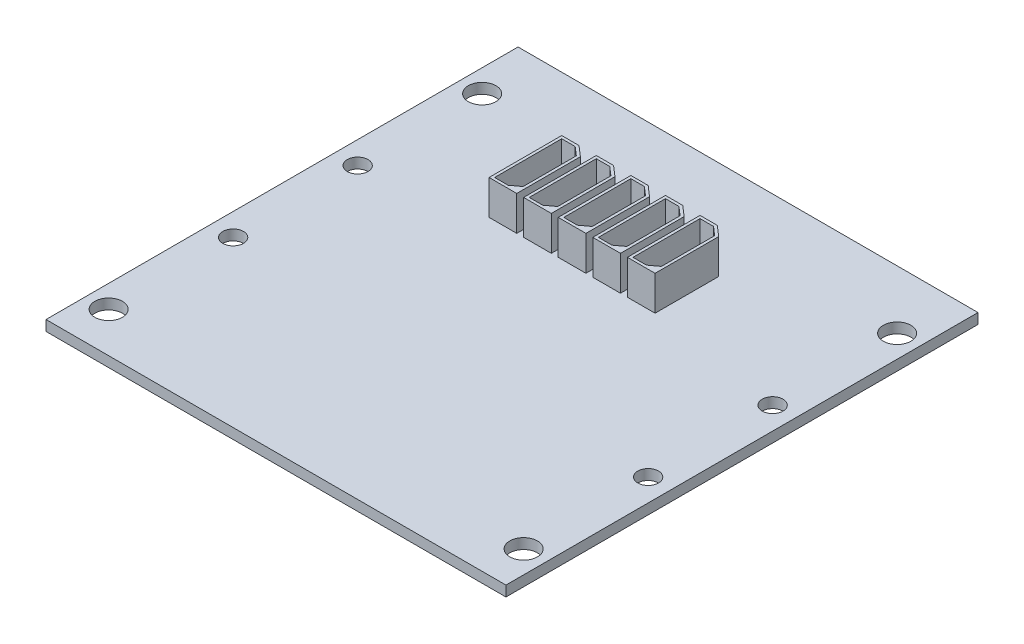
from build123d import *

# Parameters (mm, degrees)
SKETCH1_W           = 66.5
SKETCH1_H           = 68.25
BOSS_EXTRUDE1_DEPTH = 1.5
SKETCH3_R           = 2
SKETCH3_R_2         = 1.5
CUT_EXTRUDE1_DEPTH  = 48.668942982
BOSS_EXTRUDE2_DEPTH = 5


with BuildPart() as part:
    # Sketch1 → Boss-Extrude1 (new body)
    with BuildSketch(Plane(origin=(0, 0, 0), x_dir=(1, 0, 0), z_dir=(0, 1, 0))):
        Rectangle(SKETCH1_W, SKETCH1_H)
    extrude(amount=BOSS_EXTRUDE1_DEPTH)

    # Sketch3 → Cut-Extrude1 (cut, through all)
    with BuildSketch(Plane(origin=(0, 1.5, 0), x_dir=(1, 0, 0), z_dir=(0, 1, 0))):
        with Locations(Location((-30, -28.317585536, 0), (0, 0, 270))):
            Circle(SKETCH3_R)
        with Locations(Location((30, -28.317585536, 0), (0, 0, 270))):
            Circle(SKETCH3_R)
        with Locations(Location((30, 25.682414464, 0), (0, 0, 270))):
            Circle(SKETCH3_R)
        with Locations(Location((-30, 25.682414464, 0), (0, 0, 270))):
            Circle(SKETCH3_R)
        with Locations(Location((30, 7.682414464, 0), (0, 0, 270))):
            Circle(SKETCH3_R_2)
        with Locations(Location((30, -10.317585536, 0), (0, 0, 270))):
            Circle(SKETCH3_R_2)
        with Locations(Location((-30, -10.317585536, 0), (0, 0, 90))):
            Circle(SKETCH3_R_2)
        with Locations(Location((-30, 7.682414464, 0), (0, 0, 90))):
            Circle(SKETCH3_R_2)
    extrude(amount=-CUT_EXTRUDE1_DEPTH, mode=Mode.SUBTRACT)

    # Sketch5 → Boss-Extrude2 (add)
    # profile 1 of 5: a face of its own
    with BuildSketch(Plane(origin=(0, 1.5, 0), x_dir=(1, 0, 0), z_dir=(0, 1, 0))):
        Polygon((-14.006270714, 21.19159661), (-11.506270714, 21.19159661), (-10.006270714, 19.89159661), (-10.006270714, 10.69159661), (-14.006270714, 10.69159661), align=None)
        Polygon((-10.406270714, 19.708945057), (-10.406270714, 12.008945057), (-11.656270714, 11.09159661), (-13.606270714, 11.09159661), (-13.606270714, 20.79159661), (-11.655484044, 20.79159661), align=None, mode=Mode.SUBTRACT)
    # profile 2 of 5: a face of its own
    with BuildSketch(Plane(origin=(0, 1.5, 0), x_dir=(1, 0, 0), z_dir=(0, 1, 0))):
        Polygon((-9.006270714, 21.19159661), (-6.506270714, 21.19159661), (-5.006270714, 19.89159661), (-5.006270714, 10.69159661), (-9.006270714, 10.69159661), align=None)
        Polygon((-5.406270714, 19.708945057), (-5.406270714, 12.008945057), (-6.656270714, 11.09159661), (-8.606270714, 11.09159661), (-8.606270714, 20.79159661), (-6.655484044, 20.79159661), align=None, mode=Mode.SUBTRACT)
    # profile 3 of 5: a face of its own
    with BuildSketch(Plane(origin=(0, 1.5, 0), x_dir=(1, 0, 0), z_dir=(0, 1, 0))):
        Polygon((-4.006270714, 21.19159661), (-1.506270714, 21.19159661), (-0.006270714, 19.89159661), (-0.006270714, 10.69159661), (-4.006270714, 10.69159661), align=None)
        Polygon((-0.406270714, 19.708945057), (-0.406270714, 12.008945057), (-1.656270714, 11.09159661), (-3.606270714, 11.09159661), (-3.606270714, 20.79159661), (-1.655484044, 20.79159661), align=None, mode=Mode.SUBTRACT)
    # profile 4 of 5: a face of its own
    with BuildSketch(Plane(origin=(0, 1.5, 0), x_dir=(1, 0, 0), z_dir=(0, 1, 0))):
        Polygon((0.993729286, 21.19159661), (3.493729286, 21.19159661), (4.993729286, 19.89159661), (4.993729286, 10.69159661), (0.993729286, 10.69159661), align=None)
        Polygon((4.593729286, 19.708945057), (4.593729286, 12.008945057), (3.343729286, 11.09159661), (1.393729286, 11.09159661), (1.393729286, 20.79159661), (3.344515956, 20.79159661), align=None, mode=Mode.SUBTRACT)
    # profile 5 of 5: a face of its own
    with BuildSketch(Plane(origin=(0, 1.5, 0), x_dir=(1, 0, 0), z_dir=(0, 1, 0))):
        Polygon((5.993729286, 21.19159661), (8.493729286, 21.19159661), (9.993729286, 19.89159661), (9.993729286, 10.69159661), (5.993729286, 10.69159661), align=None)
        Polygon((9.593729286, 19.708945057), (9.593729286, 12.008945057), (8.343729286, 11.09159661), (6.393729286, 11.09159661), (6.393729286, 20.79159661), (8.344515956, 20.79159661), align=None, mode=Mode.SUBTRACT)
    extrude(amount=BOSS_EXTRUDE2_DEPTH)


solid = part.part
